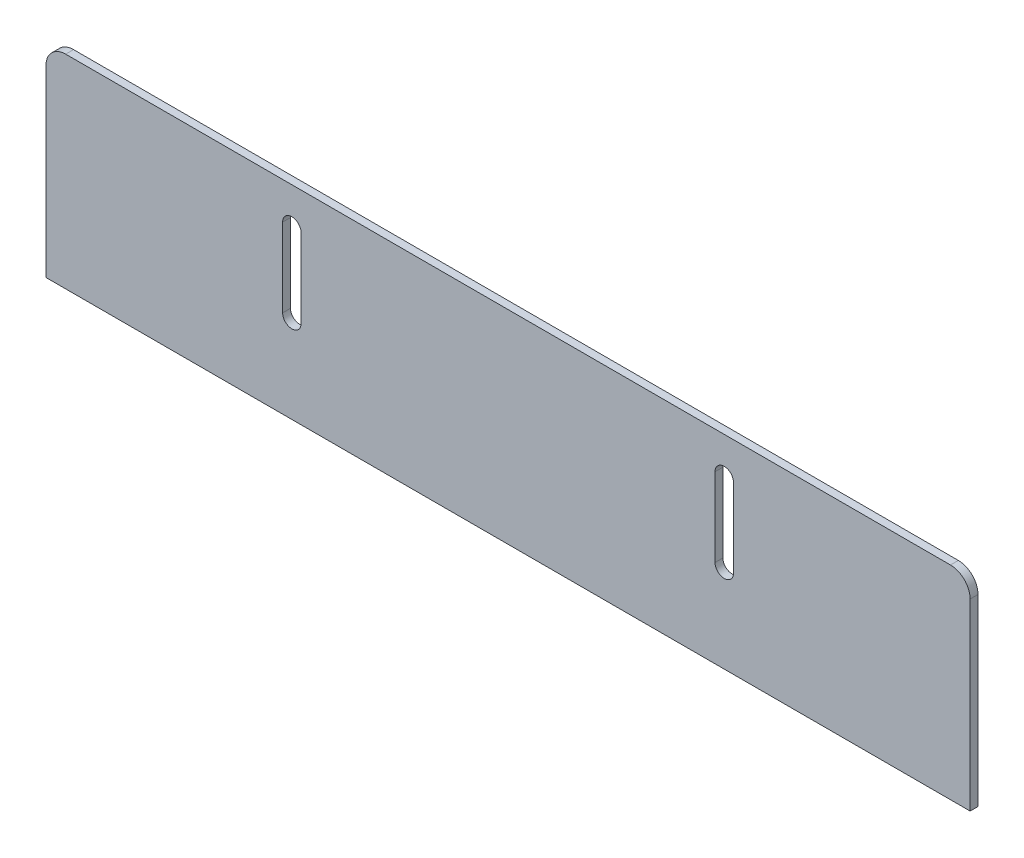
from build123d import *

# Parameters (mm, degrees)
EXTRUDE_1_DEPTH = 2


with BuildPart() as part:
    # 草图1 → 凸台-拉伸1 (new body)
    with BuildSketch(Plane.XY):
        with BuildLine():
            Line((0, 0), (235.10143352, 0))
            Line((235.10143352, 0), (235.10143352, 46.722315374))
            ThreePointArc((235.10143352, 46.722315374), (233.636967425, 50.25784928), (230.10143352, 51.722315374))
            Line((230.10143352, 51.722315374), (5, 51.722315374))
            ThreePointArc((5, 51.722315374), (1.464466094, 50.25784928), (0, 46.722315374))
            Line((0, 46.722315374), (0, 0))
        make_face()
        with BuildLine():
            Line((60.199702425, 42.318258034), (60.199702425, 22.318258034))
            ThreePointArc((60.199702425, 22.318258034), (62.55071676, 19.967243698), (64.901731095, 22.318258034))
            Line((64.901731095, 22.318258034), (64.901731095, 42.318258034))
            ThreePointArc((64.901731095, 42.318258034), (62.55071676, 44.669272369), (60.199702425, 42.318258034))
        make_face(mode=Mode.SUBTRACT)
        with BuildLine():
            Line((170.199702425, 42.318258034), (170.199702425, 22.318258034))
            ThreePointArc((170.199702425, 22.318258034), (172.55071676, 19.967243698), (174.901731095, 22.318258034))
            Line((174.901731095, 22.318258034), (174.901731095, 42.318258034))
            ThreePointArc((174.901731095, 42.318258034), (172.55071676, 44.669272369), (170.199702425, 42.318258034))
        make_face(mode=Mode.SUBTRACT)
    extrude(amount=EXTRUDE_1_DEPTH)


solid = part.part
